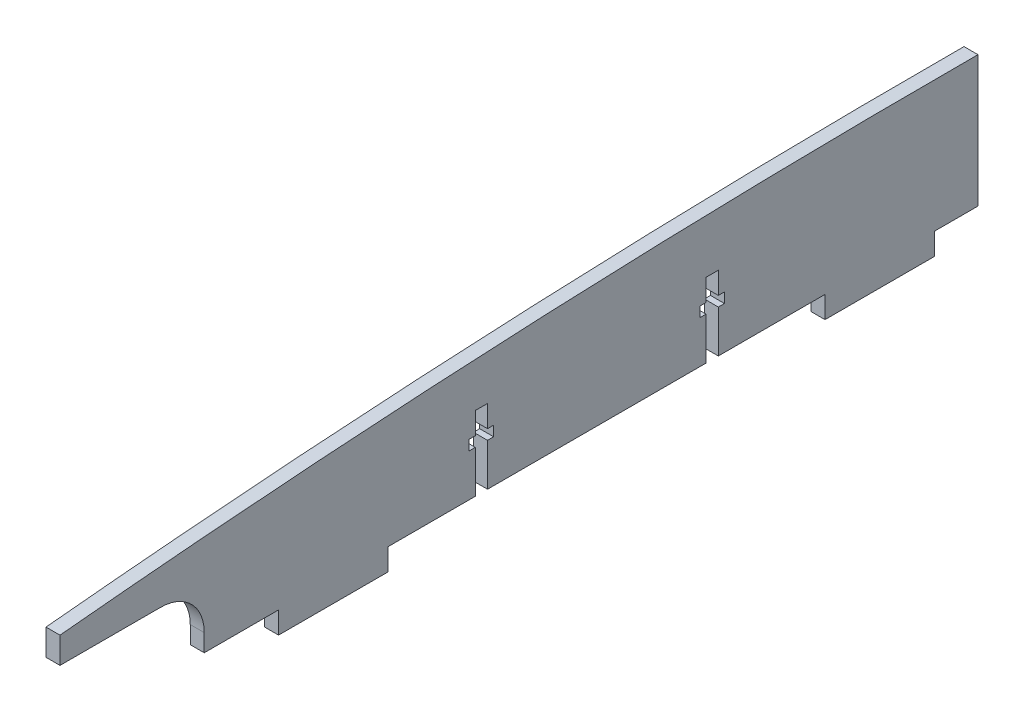
from build123d import *

# Parameters (mm, degrees)
MAIN_DEPTH        = 3.2
WHEEL_DEPTH       = 3.2
SKETCH3_W         = 25
SKETCH3_H         = 5
TABS_DEPTH        = 3.2
SCREW_HOLES_DEPTH = 3.2


with BuildPart() as part:
    # Sketch1 → main (new body)
    with BuildSketch(Plane(origin=(0, 0, 0), x_dir=(0, 0, -1), z_dir=(1, 0, 0))):
        with BuildLine():
            Line((-87.535437106, 0), (122.464562894, 0))
            Line((122.464562894, 0), (122.464562894, 30))
            add(Edge.make_bspline(
                [(-87.535437106, 20), (17.331032425, 30.296907598), (122.464562894, 30)],
                knots=[0, 0, 0, 1, 1, 1], degree=2))
            Line((-87.535437106, 20), (-87.535437106, 0))
        make_face()
    extrude(amount=MAIN_DEPTH)

    # Sketch2 → wheel (cut)
    with BuildSketch(Plane(origin=(3.2, 0, 0), x_dir=(0, 0, -1), z_dir=(1, 0, 0))):
        with BuildLine():
            Line((-87.535437106, 0), (-54.535437106, 0))
            Line((-54.535437106, 0), (-54.535437106, 4))
            ThreePointArc((-54.535437106, 4), (-57.464369294, 11.071067812), (-64.535437106, 14))
            Line((-64.535437106, 14), (-87.535437106, 14))
            Line((-87.535437106, 14), (-87.535437106, 0))
        make_face()
    extrude(amount=-WHEEL_DEPTH, mode=Mode.SUBTRACT)

    # Sketch3 → tabs (add)
    with BuildSketch(Plane(origin=(3.2, 0, 0), x_dir=(0, 0, -1), z_dir=(1, 0, 0))):
        with Locations((-25.035437106, -2.5)):
            Rectangle(SKETCH3_W, SKETCH3_H)
        with Locations((99.964562894, -2.5)):
            Rectangle(SKETCH3_W, SKETCH3_H)
    extrude(amount=-TABS_DEPTH)

    # Sketch5 → screw holes (cut)
    with BuildSketch(Plane(origin=(3.2, 0, 0), x_dir=(0, 0, -1), z_dir=(1, 0, 0))):
        Polygon((7.464562894, 0), (10.264562894, 0), (10.264562894, 9.7), (11.664562894, 9.7), (11.664562894, 12), (10.264562894, 12), (10.264562894, 17), (7.464562894, 17), (7.464562894, 12), (6.064562894, 12), (6.064562894, 9.7), (7.464562894, 9.7), align=None)
        Polygon((60.264562894, 0), (63.064562894, 0), (63.064562894, 9.7), (64.464562894, 9.7), (64.464562894, 12), (63.064562894, 12), (63.064562894, 17), (60.264562894, 17), (60.264562894, 12), (58.864562894, 12), (58.864562894, 9.7), (60.264562894, 9.7), align=None)
    extrude(amount=-SCREW_HOLES_DEPTH, mode=Mode.SUBTRACT)


solid = part.part
